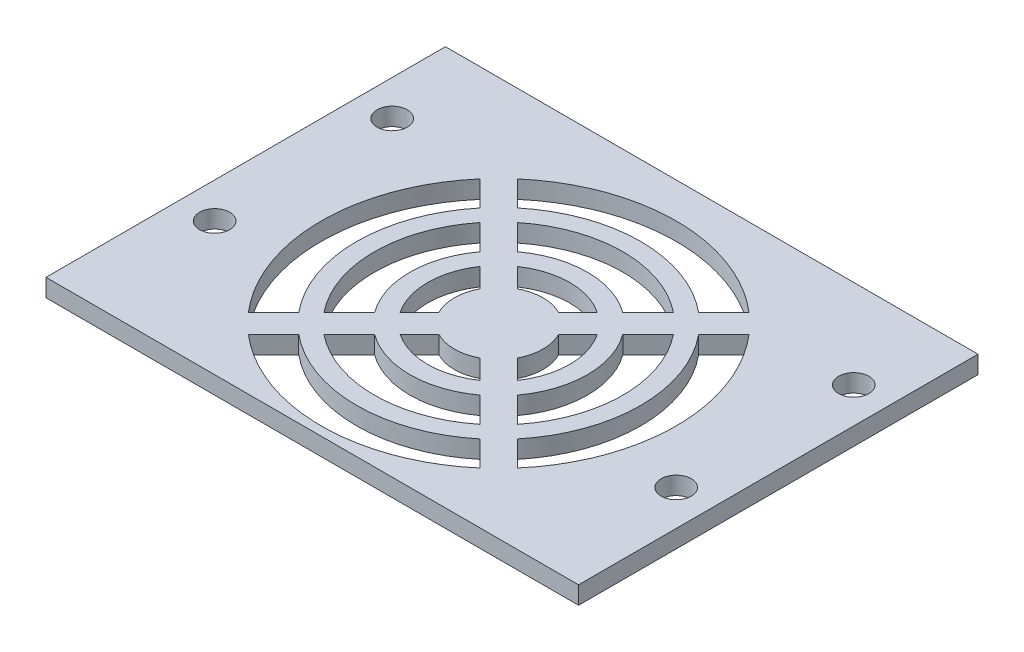
from build123d import *

# Parameters (mm, degrees)
SKETCH1_W                  = 60
SKETCH1_H                  = 45
BOSS_EXTRUDE1_DEPTH        = 2
F_3_4_3_4_DIAMETER_HOLE1_D = 3.4
SKETCH5_R                  = 2.5
AIR_HOLES_DEPTH            = 76.026661928
CIRPATTERN1_COUNT          = 4
SKETCH6_R                  = 2.5
BOSS_EXTRUDE3_DEPTH        = 2


with BuildPart() as part:
    # Sketch1 → Boss-Extrude1 (new body)
    with BuildSketch(Plane(origin=(0, 0, 0), x_dir=(1, 0, 0), z_dir=(0, 1, 0))):
        with Locations((30, 22.5)):
            Rectangle(SKETCH1_W, SKETCH1_H)
    extrude(amount=BOSS_EXTRUDE1_DEPTH)

    # Ø3.4 (3.4) Diameter Hole1 (through all)
    with Locations(Plane(origin=(0, 2, 0), x_dir=(1, 0, 0), z_dir=(0, 1, 0))):
        with Locations((4, 15), (4, 35), (56, 35), (56, 15)):
            Hole(F_3_4_3_4_DIAMETER_HOLE1_D / 2)

    # Sketch5 → Air holes (cut, through all)
    with BuildSketch(Plane(origin=(0, 2, 0), x_dir=(1, 0, 0), z_dir=(0, 1, 0))):
        with Locations(Location((30, 21, 0), (0, 0, 270))):
            Circle(SKETCH5_R)
        with BuildLine():
            Line((21.218150329, 31.903170014), (24.069594445, 29.051725899))
            ThreePointArc((24.069594445, 29.051725899), (30, 31), (35.930405555, 29.051725899))
            Line((35.930405555, 29.051725899), (38.781849671, 31.903170014))
            ThreePointArc((38.781849671, 31.903170014), (30, 35), (21.218150329, 31.903170014))
        make_face()
        with BuildLine():
            Line((25.504132479, 27.617187865), (27.687975781, 25.433344563))
            ThreePointArc((27.687975781, 25.433344563), (30, 26), (32.312024219, 25.433344563))
            Line((32.312024219, 25.433344563), (34.495867521, 27.617187865))
            ThreePointArc((34.495867521, 27.617187865), (30, 29), (25.504132479, 27.617187865))
        make_face()
        with BuildLine():
            Line((40.203220154, 33.324540498), (43.041644604, 36.162964948))
            ThreePointArc((43.041644604, 36.162964948), (30, 41), (16.958355396, 36.162964948))
            Line((16.958355396, 36.162964948), (19.796779846, 33.324540498))
            ThreePointArc((19.796779846, 33.324540498), (30, 37), (40.203220154, 33.324540498))
        make_face()
    air_holes = extrude(amount=-AIR_HOLES_DEPTH, mode=Mode.SUBTRACT)

    # CirPattern1: Air holes ×4 about axis
    cirpattern1_axis = Axis((30, 0, -21), (0, 1, 0))
    for i in range(1, CIRPATTERN1_COUNT):
        add(air_holes.rotate(cirpattern1_axis, i * 360 / CIRPATTERN1_COUNT), mode=Mode.SUBTRACT)

    # Sketch6 → Boss-Extrude3 (add)
    with BuildSketch(Plane(origin=(0, 2, 0), x_dir=(1, 0, 0), z_dir=(0, 1, 0))):
        with Locations((30, 21)):
            Circle(SKETCH6_R)
    extrude(amount=-BOSS_EXTRUDE3_DEPTH)


solid = part.part
